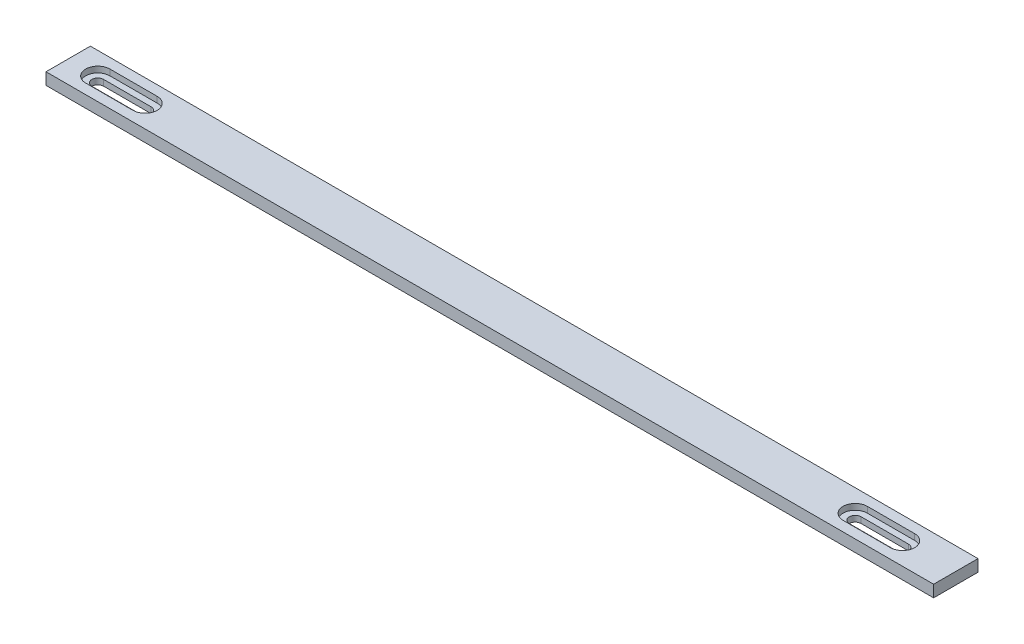
from build123d import *

# Parameters (mm, degrees)
SKETCH1_W           = 15
SKETCH1_H           = 4
BOSS_EXTRUDE1_DEPTH = 300
CUT_EXTRUDE1_DEPTH  = 301.401398133
CUT_EXTRUDE2_DEPTH  = 2


with BuildPart() as part:
    # Sketch1 → Boss-Extrude1 (new body)
    with BuildSketch(Plane(origin=(0, 0, 0), x_dir=(0, 0, -1), z_dir=(1, 0, 0))):
        with Locations((7.5, -2)):
            Rectangle(SKETCH1_W, SKETCH1_H)
    extrude(amount=BOSS_EXTRUDE1_DEPTH)

    # Sketch3 → Cut-Extrude1 (cut, through all)
    with BuildSketch(Plane(origin=(0, 0, 0), x_dir=(1, 0, 0), z_dir=(0, 1, 0))):
        with BuildLine():
            Line((10, 9.5), (26, 9.5))
            ThreePointArc((26, 9.5), (28, 7.5), (26, 5.5))
            Line((26, 5.5), (10, 5.5))
            ThreePointArc((10, 5.5), (8, 7.5), (10, 9.5))
        make_face()
        with BuildLine():
            Line((266, 9.5), (282, 9.5))
            ThreePointArc((282, 9.5), (284, 7.5), (282, 5.5))
            Line((282, 5.5), (266, 5.5))
            ThreePointArc((266, 5.5), (264, 7.5), (266, 9.5))
        make_face()
    extrude(amount=-CUT_EXTRUDE1_DEPTH, mode=Mode.SUBTRACT)

    # Sketch4 → Cut-Extrude2 (cut)
    with BuildSketch(Plane(origin=(0, 0, 0), x_dir=(1, 0, 0), z_dir=(0, 1, 0))):
        with BuildLine():
            Line((10, 11.6), (26, 11.6))
            ThreePointArc((26, 11.6), (30.1, 7.5), (26, 3.4))
            Line((26, 3.4), (10, 3.4))
            ThreePointArc((10, 3.4), (5.9, 7.5), (10, 11.6))
        make_face()
        with BuildLine():
            Line((266, 11.6), (282, 11.6))
            ThreePointArc((282, 11.6), (286.1, 7.5), (282, 3.4))
            Line((282, 3.4), (266, 3.4))
            ThreePointArc((266, 3.4), (261.9, 7.5), (266, 11.6))
        make_face()
    extrude(amount=-CUT_EXTRUDE2_DEPTH, mode=Mode.SUBTRACT)


solid = part.part
